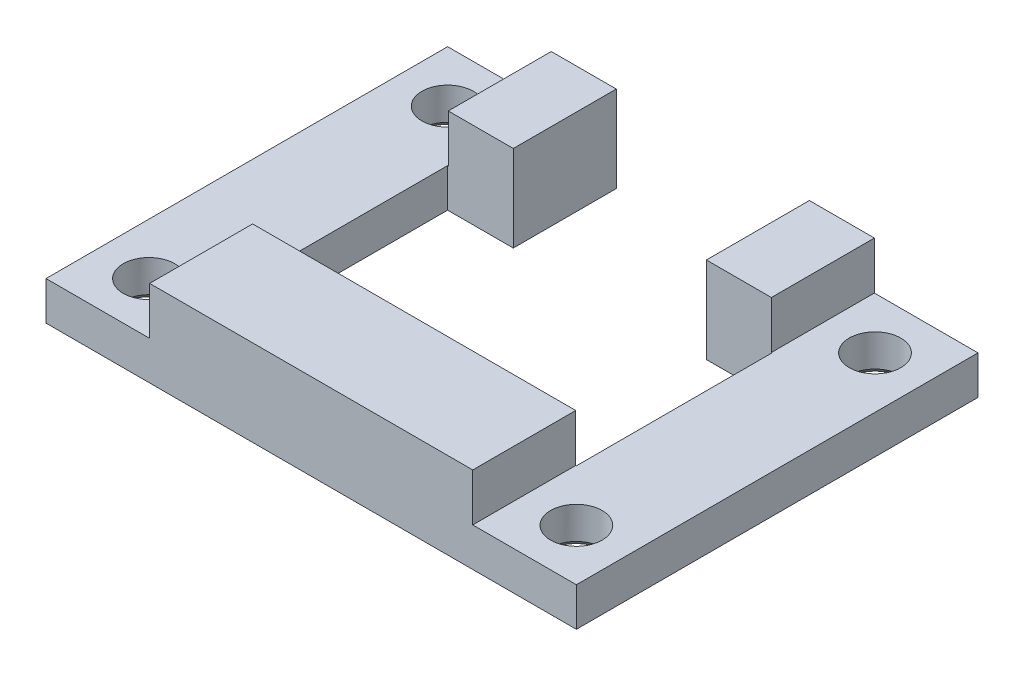
from build123d import *

# Parameters (mm, degrees)
SKETCH1_W           = 41.2
SKETCH1_H           = 31.2
BOSS_EXTRUDE1_DEPTH = 3
SKETCH2_W           = 25.1
SKETCH2_H           = 31.2
BOSS_EXTRUDE2_DEPTH = 3.7
SKETCH3_R           = 2
CUT_EXTRUDE1_DEPTH  = 3
CUT_EXTRUDE2_REACH  = 28.695
CHAMFER1_SIZE       = 0.5


with BuildPart() as part:
    # Sketch1 → Boss-Extrude1 (new body)
    with BuildSketch(Plane(origin=(0, 0, 0), x_dir=(1, 0, 0), z_dir=(0, 1, 0))):
        Rectangle(SKETCH1_W, SKETCH1_H)
    extrude(amount=BOSS_EXTRUDE1_DEPTH)

    # Sketch2 → Boss-Extrude2 (add)
    with BuildSketch(Plane(origin=(0, 3, 0), x_dir=(1, 0, 0), z_dir=(0, 1, 0))):
        Rectangle(SKETCH2_W, SKETCH2_H)
    extrude(amount=BOSS_EXTRUDE2_DEPTH)

    # Sketch3 → Cut-Extrude1 (cut)
    with BuildSketch(Plane(origin=(0, 3, 0), x_dir=(1, 0, 0), z_dir=(0, 1, 0))):
        with Locations(Location((16.6, -11.6, 0), (0, 0, 270))):
            Circle(SKETCH3_R)
        with Locations(Location((-16.6, -11.6, 0), (0, 0, 270))):
            Circle(SKETCH3_R)
        with Locations(Location((16.6, 11.6, 0), (0, 0, 270))):
            Circle(SKETCH3_R)
        with Locations(Location((-16.6, 11.6, 0), (0, 0, 270))):
            Circle(SKETCH3_R)
    extrude(amount=-CUT_EXTRUDE1_DEPTH, mode=Mode.SUBTRACT)

    # Cut-Extrude2: up to this face of the body (flat: up to its plane)
    cut_extrude2_end = Plane(part.part.faces().sort_by_distance((0, 6.7, 0))[0])
    # Sketch4 → Cut-Extrude2 (cut, up to the picked face)
    with BuildSketch(Plane.XZ, mode=Mode.PRIVATE) as cut_extrude2_sk1:
        Polygon((-7.5, -15.6), (7.5, -15.6), (7.5, -7.6), (12.6, -7.6), (12.6, 7.6), (-12.6, 7.6), (-12.6, -7.6), (-7.5, -7.6), align=None)
    cut_extrude2_tool1 = split(extrude(cut_extrude2_sk1.sketch, amount=-CUT_EXTRUDE2_REACH, mode=Mode.PRIVATE), bisect_by=cut_extrude2_end, keep=Keep.BOTH, mode=Mode.PRIVATE)
    add(cut_extrude2_tool1.solids().sort_by(Axis((0, 0, -2.767176), (0, 1, 0)))[0], mode=Mode.SUBTRACT)

    # Chamfer1
    chamfer1_edges = [part.edges().sort_by_distance(p)[0] for p in [
        (16.6, 0, -13.6),
        (-16.6, 0, 9.6),
        (-16.6, 0, -13.6),
        (16.6, 0, 9.6),
    ]]
    chamfer(chamfer1_edges, length=CHAMFER1_SIZE)


solid = part.part
